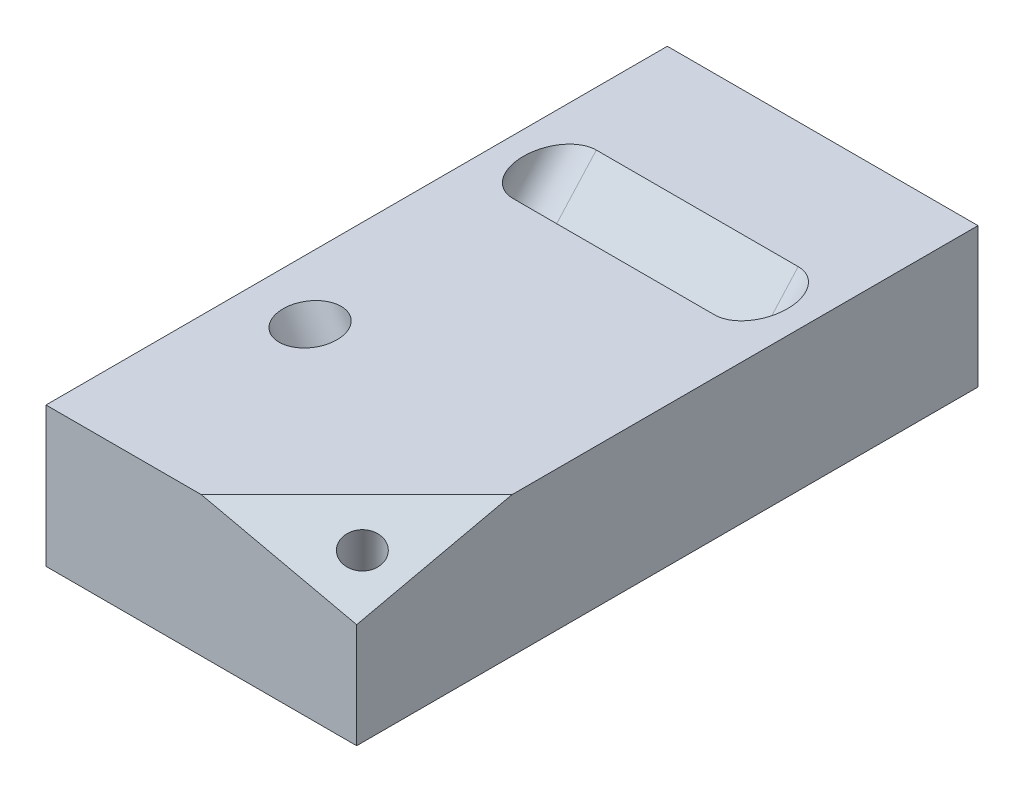
from build123d import *

# Parameters (mm, degrees)
SKETCH1_W           = 200
SKETCH1_H           = 400
BOSS_EXTRUDE1_DEPTH = 90
CUT_EXTRUDE2_DEPTH  = 289.26854046
SKETCH4_3_R         = 11.813497964
CUT_EXTRUDE4_DEPTH  = 289.26854046
SKETCH10_RX         = 20
SKETCH10_RY         = 15
CUT_EXTRUDE5_DEPTH  = 100
CUT_EXTRUDE6_DEPTH  = 380.479144091


with BuildPart() as part:
    # Sketch1 → Boss-Extrude1 (new body)
    with BuildSketch(Plane(origin=(0, 0, 0), x_dir=(1, 0, 0), z_dir=(0, 1, 0))):
        Rectangle(SKETCH1_W, SKETCH1_H)
    extrude(amount=BOSS_EXTRUDE1_DEPTH)

    # Sketch4 → Cut-Extrude2 (cut, through all)
    with BuildSketch(Plane(origin=(27.582292849, 122.587968218, 27.582292849), x_dir=(-0.9767443431718839, 0.20917784862693525, 0.04706501594106042), z_dir=(-0.21440729484260865, -0.9529213104115941, -0.21440729484260865))):
        Polygon((28.239009565, -175.365853659), (-74.141926347, -77.804878049), (-74.141926347, -180.304878049), align=None)
    extrude(amount=-CUT_EXTRUDE2_DEPTH, mode=Mode.SUBTRACT)

    # Sketch4<3> → Cut-Extrude4 (cut, through all)
    with BuildSketch(Plane(origin=(27.582292849, 122.587968218, 27.582292849), x_dir=(-0.9767443431718839, 0.20917784862693525, 0.04706501594106042), z_dir=(-0.21440729484260865, -0.9529213104115941, -0.21440729484260865))):
        with Locations((-46.760990435, -147.804878049)):
            Circle(SKETCH4_3_R)
    extrude(amount=CUT_EXTRUDE4_DEPTH, mode=Mode.SUBTRACT)

    # Sketch10 → Cut-Extrude5 (cut)
    with BuildSketch(Plane(origin=(-63.97114317, 110.801270189, 0), x_dir=(0, 0, 1), z_dir=(-0.500000000000001, 0.866025403784438, 0))):
        with Locations(Location((70, -6.961524227), (0, 0, 180))):
            Ellipse(SKETCH10_RX, SKETCH10_RY)
    extrude(amount=-CUT_EXTRUDE5_DEPTH, mode=Mode.SUBTRACT)

    # Sketch11 → Cut-Extrude6 (cut, through all)
    with BuildSketch(Plane(origin=(0, 149.155970384, -134.300638965), x_dir=(-1, 0, 0), z_dir=(0, 0.7431448254773932, -0.6691306063588595))):
        with BuildLine():
            Line((-65, 11.592789477), (65, 11.592789477))
            ThreePointArc((65, 11.592789477), (85, -8.407210523), (65, -28.407210523))
            Line((65, -28.407210523), (-65, -28.407210523))
            ThreePointArc((-65, -28.407210523), (-85, -8.407210523), (-65, 11.592789477))
        make_face()
    extrude(amount=-CUT_EXTRUDE6_DEPTH, mode=Mode.SUBTRACT)


solid = part.part
